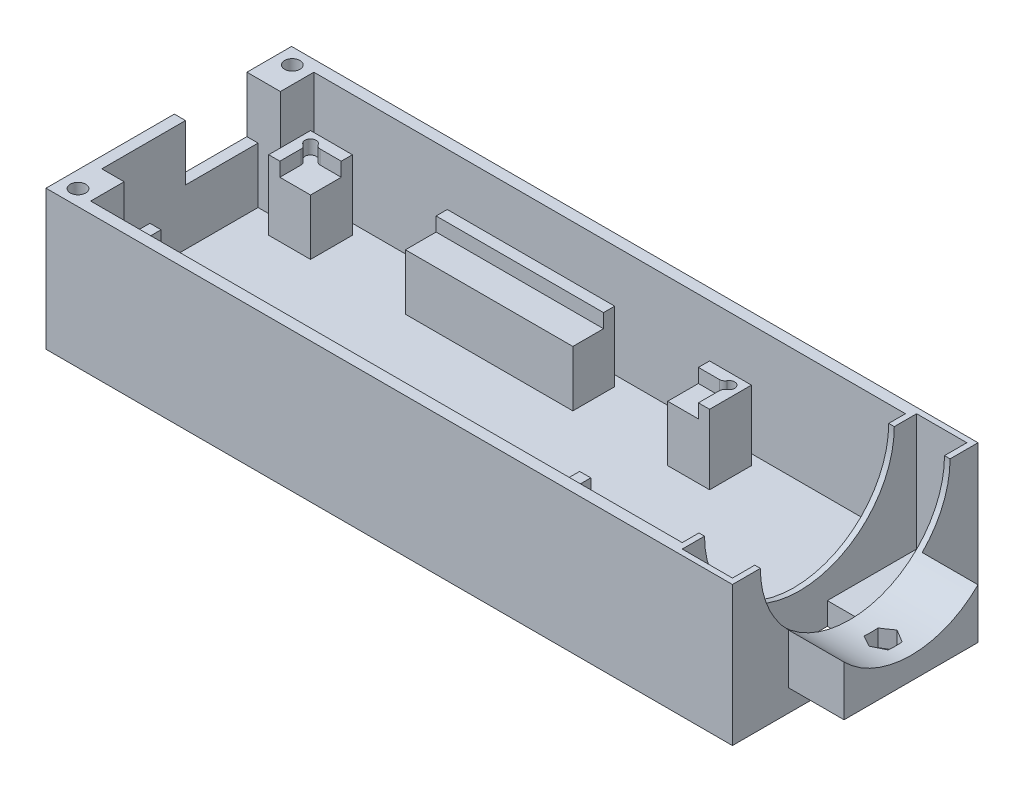
from build123d import *

# Parameters (mm, degrees)
SKETCH3_W           = 520.7
SKETCH3_H           = 111.76
BOSS_EXTRUDE1_DEPTH = 63.5
CUT_EXTRUDE1_START  = 6.35
SKETCH2_W           = 77.47
SKETCH2_H           = 77.47
CUT_EXTRUDE1_DEPTH  = 111.76
CUT_EXTRUDE2_DEPTH  = 156.718
SKETCH5_R           = 43.18
CUT_EXTRUDE3_DEPTH  = 355.6
SKETCH6_W           = 279.4
SKETCH6_H           = 101.6
CUT_EXTRUDE4_DEPTH  = 50.8
CUT_EXTRUDE5_DEPTH  = 174.244
SKETCH9_W           = 25.4
SKETCH9_H           = 60.96
CUT_EXTRUDE6_DEPTH  = 10.16
BOSS_EXTRUDE2_REACH = 310.043
SKETCH11_W          = 15.24
SKETCH11_H          = 20.32
SKETCH10_R          = 3.5
CUT_EXTRUDE7_DEPTH  = 76.2
SKETCH10_3_R        = 5.5
CUT_EXTRUDE8_DEPTH  = 45.72
SKETCH13_R          = 3.5
CUT_EXTRUDE9_DEPTH  = 34.448
CUT_EXTRUDE10_START = -2.54
SKETCH13_3_R        = 3.5
CUT_EXTRUDE10_DEPTH = 34.448
SKETCH14_W          = 19.05
SKETCH14_H          = 19.05
SKETCH14_W_2        = 76.2
BOSS_EXTRUDE3_DEPTH = 25.4
SKETCH14_3_W        = 76.2
SKETCH14_3_H        = 5.08
BOSS_EXTRUDE4_DEPTH = 31.75
SKETCH16_W          = 22.86
SKETCH16_H          = 106.68
CUT_EXTRUDE12_DEPTH = 53.34
SKETCH17_W          = 22.86
SKETCH17_H          = 25.4
CUT_EXTRUDE13_DEPTH = 52.54
SKETCH18_W          = 33.02
SKETCH18_H          = 25.4
CUT_EXTRUDE14_DEPTH = 17.018
SKETCH19_R          = 2.54
CUT_EXTRUDE15_DEPTH = 23.876
FILLET1_R           = 2.54


with BuildPart() as part:
    # Sketch3 → Boss-Extrude1 (new body)
    with BuildSketch(Plane(origin=(0, 0, 0), x_dir=(1, 0, 0), z_dir=(0, 1, 0))):
        with Locations((209.55, 36.195)):
            Rectangle(SKETCH3_W, SKETCH3_H)
    extrude(amount=BOSS_EXTRUDE1_DEPTH)

    # Sketch2 → Cut-Extrude1 (cut)
    with BuildSketch(Plane(origin=(0, 0, 0), x_dir=(1, 0, 0), z_dir=(0, 1, 0)).offset(CUT_EXTRUDE1_START)):
        with Locations((412.75, 36.195)):
            Rectangle(SKETCH2_W, SKETCH2_H)
    extrude(amount=CUT_EXTRUDE1_DEPTH, mode=Mode.SUBTRACT)

    # Sketch4 → Cut-Extrude2 (cut)
    with BuildSketch(Plane.XY.offset(19.685)):
        with BuildLine():
            Line((330.2, 12.7), (469.9, 12.7))
            Line((469.9, 12.7), (469.9, 63.5))
            Line((469.9, 63.5), (381, 63.5))
            ThreePointArc((381, 63.5), (294.278975516, 99.421024484), (330.2, 12.7))
        make_face()
    extrude(amount=-CUT_EXTRUDE2_DEPTH, mode=Mode.SUBTRACT)

    # Sketch5 → Cut-Extrude3 (cut)
    with BuildSketch(Plane(origin=(0, 0, 0), x_dir=(0, 0, -1), z_dir=(1, 0, 0))):
        with Locations((36.195, 63.5)):
            Circle(SKETCH5_R)
    extrude(amount=CUT_EXTRUDE3_DEPTH, mode=Mode.SUBTRACT)

    # Sketch6 → Cut-Extrude4 (cut)
    with BuildSketch(Plane(origin=(0, 63.5, 0), x_dir=(1, 0, 0), z_dir=(0, 1, 0))):
        with Locations((93.98, 36.195)):
            Rectangle(SKETCH6_W, SKETCH6_H)
    extrude(amount=-CUT_EXTRUDE4_DEPTH, mode=Mode.SUBTRACT)

    # Sketch7 → Cut-Revolve1 (revolve, cut)
    with BuildSketch(Plane(origin=(0, 63.5, 0), x_dir=(1, 0, 0), z_dir=(0, 1, 0))):
        with BuildLine():
            Line((241.3, -13.805), (245.161436971, -13.805))
            ThreePointArc((245.161436971, -13.805), (249.759619592, 11.007294884), (251.3, 36.195))
            Line((251.3, 36.195), (241.3, 36.195))
            Line((241.3, 36.195), (241.3, -13.805))
        make_face()
    revolve(axis=Axis((-45.72, 63.5, -36.195), (1, 0, 0)), mode=Mode.SUBTRACT)

    # Sketch8 → Cut-Extrude5 (cut)
    with BuildSketch(Plane.XZ):
        Polygon((261.62, 19.685), (261.62, -5.715), (287.02, -5.715), (287.02, -66.675), (261.62, -66.675), (261.62, -92.075), (609.54801076, -173.862508288), (609.54801076, 88.425228921), align=None)
    extrude(amount=-CUT_EXTRUDE5_DEPTH, mode=Mode.SUBTRACT)

    # Sketch9 → Cut-Extrude6 (cut)
    with BuildSketch(Plane.XZ):
        with Locations((274.32, -36.195)):
            Rectangle(SKETCH9_W, SKETCH9_H)
    extrude(amount=-CUT_EXTRUDE6_DEPTH, mode=Mode.SUBTRACT)

    # Sketch11 → Boss-Extrude2 (add, up to next)
    with BuildSketch(Plane(origin=(0, 63.5, 0), x_dir=(1, 0, 0), z_dir=(0, 1, 0)), mode=Mode.PRIVATE) as boss_extrude2_sk1:
        with Locations((-43.18, 81.915)):
            Rectangle(SKETCH11_W, SKETCH11_H)
    boss_extrude2_tool1 = extrude(boss_extrude2_sk1.sketch, amount=-BOSS_EXTRUDE2_REACH, mode=Mode.PRIVATE) - part.part
    # Sketch11 → Boss-Extrude2 (add, up to next)
    with BuildSketch(Plane(origin=(0, 63.5, 0), x_dir=(1, 0, 0), z_dir=(0, 1, 0)), mode=Mode.PRIVATE) as boss_extrude2_sk2:
        with Locations((-43.18, -9.525)):
            Rectangle(SKETCH11_W, SKETCH11_H)
    boss_extrude2_tool2 = extrude(boss_extrude2_sk2.sketch, amount=-BOSS_EXTRUDE2_REACH, mode=Mode.PRIVATE) - part.part
    add(boss_extrude2_tool1.solids().sort_by_distance((-43.18, 63.5, -81.915))[0])
    add(boss_extrude2_tool2.solids().sort_by_distance((-43.18, 63.5, 9.525))[0])

    # Sketch10 → Cut-Extrude7 (cut)
    with BuildSketch(Plane.XZ):
        with Locations((-43.346, -84.963)):
            Circle(SKETCH10_R)
        with Locations((-43.346, 12.573)):
            Circle(SKETCH10_R)
    extrude(amount=-CUT_EXTRUDE7_DEPTH, mode=Mode.SUBTRACT)

    # Sketch10<3> → Cut-Extrude8 (cut)
    with BuildSketch(Plane.XZ):
        with Locations((-43.346, 12.573)):
            Circle(SKETCH10_3_R)
        with Locations((-43.346, -84.963)):
            Circle(SKETCH10_3_R)
    extrude(amount=-CUT_EXTRUDE8_DEPTH, mode=Mode.SUBTRACT)

    # Sketch13 → Cut-Extrude9 (cut)
    with BuildSketch(Plane.XZ.offset(-10.16)):
        with Locations((274.32, -36.195)):
            Circle(SKETCH13_R)
    extrude(amount=-CUT_EXTRUDE9_DEPTH, mode=Mode.SUBTRACT)

    # Sketch13<3> → Cut-Extrude10 (cut)
    with BuildSketch(Plane.XZ.offset(-10.16).offset(CUT_EXTRUDE10_START)):
        Polygon((268.82, -39.370426481), (274.32, -42.545852961), (279.82, -39.370426481), (279.82, -33.019573519), (274.32, -29.844147039), (268.82, -33.019573519), align=None)
        with Locations((274.32, -36.195)):
            Circle(SKETCH13_3_R, mode=Mode.SUBTRACT)
    extrude(amount=-CUT_EXTRUDE10_DEPTH, mode=Mode.SUBTRACT)

    # Sketch14 → Boss-Extrude3 (add)
    with BuildSketch(Plane(origin=(0, 12.7, 0), x_dir=(1, 0, 0), z_dir=(0, 1, 0))):
        with Locations((-22.835, -0.36)):
            Rectangle(SKETCH14_W, SKETCH14_H)
        with Locations((67.97, -0.36)):
            Rectangle(SKETCH14_W_2, SKETCH14_H)
        with Locations((-22.835, 72.75)):
            Rectangle(SKETCH14_W, SKETCH14_H)
        with Locations((67.97, 72.75)):
            Rectangle(SKETCH14_W_2, SKETCH14_H)
        with Locations((158.775, -0.36)):
            Rectangle(SKETCH14_W, SKETCH14_H)
        with Locations((158.775, 72.75)):
            Rectangle(SKETCH14_W, SKETCH14_H)
    extrude(amount=BOSS_EXTRUDE3_DEPTH)

    # Sketch14<3> → Boss-Extrude4 (add)
    with BuildSketch(Plane(origin=(0, 12.7, 0), x_dir=(1, 0, 0), z_dir=(0, 1, 0))):
        Polygon((-13.31, -4.805), (-27.28, -4.805), (-27.28, 9.165), (-32.36, 9.165), (-32.36, -9.885), (-13.31, -9.885), align=None)
        with Locations((67.97, -7.345)):
            Rectangle(SKETCH14_3_W, SKETCH14_3_H)
        Polygon((-32.36, 63.225), (-27.28, 63.225), (-27.28, 77.195), (-13.31, 77.195), (-13.31, 82.275), (-32.36, 82.275), align=None)
        Polygon((163.22, -4.805), (149.25, -4.805), (149.25, -9.885), (168.3, -9.885), (168.3, 9.165), (163.22, 9.165), align=None)
        with Locations((67.97, 79.735)):
            Rectangle(SKETCH14_3_W, SKETCH14_3_H)
        Polygon((149.25, 82.275), (149.25, 77.195), (163.22, 77.195), (163.22, 63.225), (168.3, 63.225), (168.3, 82.275), align=None)
    extrude(amount=BOSS_EXTRUDE4_DEPTH)

    # Sketch16 → Cut-Extrude12 (cut)
    with BuildSketch(Plane(origin=(0, 63.5, 0), x_dir=(1, 0, 0), z_dir=(0, 1, 0))):
        with Locations((247.65, 36.195)):
            Rectangle(SKETCH16_W, SKETCH16_H)
    extrude(amount=-CUT_EXTRUDE12_DEPTH, mode=Mode.SUBTRACT)

    # Sketch17 → Cut-Extrude13 (cut)
    with BuildSketch(Plane(origin=(0, 10.16, 0), x_dir=(1, 0, 0), z_dir=(0, 1, 0))):
        with Locations((247.65, 36.195)):
            Rectangle(SKETCH17_W, SKETCH17_H)
    extrude(amount=-CUT_EXTRUDE13_DEPTH, mode=Mode.SUBTRACT)

    # Sketch18 → Cut-Extrude14 (cut)
    with BuildSketch(Plane.ZY.offset(50.8)):
        with Locations((-55.245, 50.8)):
            Rectangle(SKETCH18_W, SKETCH18_H)
    extrude(amount=-CUT_EXTRUDE14_DEPTH, mode=Mode.SUBTRACT)

    # Sketch19 → Cut-Extrude15 (cut)
    with BuildSketch(Plane(origin=(0, 38.1, 0), x_dir=(1, 0, 0), z_dir=(0, 1, 0))):
        with Locations((-27.28, 77.195)):
            Circle(SKETCH19_R)
        with Locations((163.22, 77.195)):
            Circle(SKETCH19_R)
        with Locations((163.22, -4.805)):
            Circle(SKETCH19_R)
        with Locations((-27.28, -4.805)):
            Circle(SKETCH19_R)
    extrude(amount=CUT_EXTRUDE15_DEPTH, mode=Mode.SUBTRACT)

    # Fillet1
    fillet1_edges = [part.edges().sort_by_distance(p)[0] for p in [
        (-24.74, 41.275, 4.805),
        (-27.28, 41.275, 2.265),
        (163.22, 41.275, 2.265),
        (160.68, 41.275, 4.805),
        (160.68, 41.275, -77.195),
        (163.22, 41.275, -74.655),
        (-27.28, 41.275, -74.655),
        (-24.74, 41.275, -77.195),
    ]]
    fillet(fillet1_edges, radius=FILLET1_R)


solid = part.part
